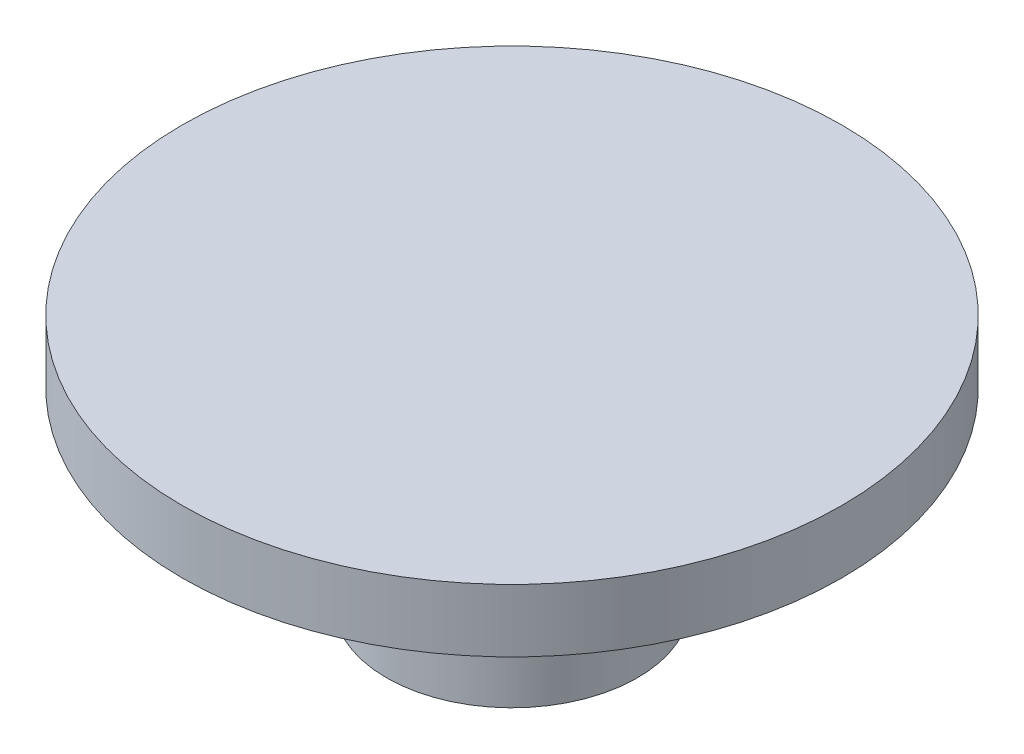
from build123d import *

# Parameters (mm, degrees)
SKETCH1_R           = 4
BOSS_EXTRUDE1_DEPTH = 6
SKETCH2_R           = 10.5
BOSS_EXTRUDE2_DEPTH = 2


with BuildPart() as part:
    # Sketch1 → Boss-Extrude1 (new body)
    with BuildSketch(Plane(origin=(0, 0, 0), x_dir=(1, 0, 0), z_dir=(0, 1, 0))):
        Circle(SKETCH1_R)
    extrude(amount=BOSS_EXTRUDE1_DEPTH)

    # Sketch2 → Boss-Extrude2 (add)
    with BuildSketch(Plane(origin=(0, 6, 0), x_dir=(1, 0, 0), z_dir=(0, 1, 0))):
        Circle(SKETCH2_R)
    extrude(amount=BOSS_EXTRUDE2_DEPTH)


solid = part.part
